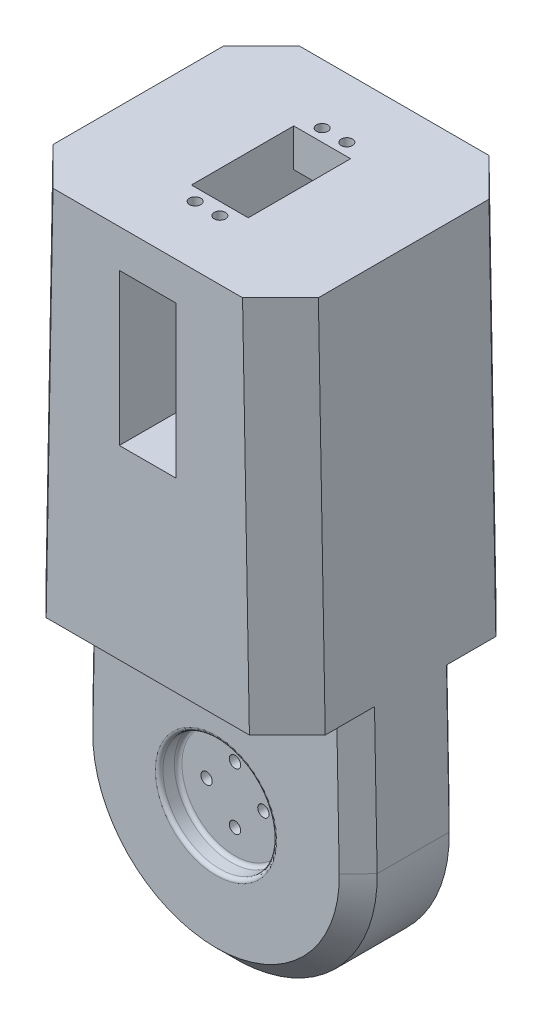
from build123d import *

# Parameters (mm, degrees)
BOSS_EXTRUDE1_DEPTH = 65
SKETCH2_W           = 18
SKETCH2_H           = 76
CUT_EXTRUDE1_DEPTH  = 48.5
CHAMFER1_SIZE       = 10
CHAMFER2_SIZE       = 5
SKETCH3_R           = 15
CUT_EXTRUDE2_DEPTH  = 5
SKETCH5_R           = 1.5
CUT_EXTRUDE3_DEPTH  = 3.75
FILLET1_R           = 1
SKETCH6_W           = 15
SKETCH6_H           = 40
CUT_EXTRUDE4_DEPTH  = 157.644501978
SKETCH7_R           = 1.5
SKETCH7_W           = 15
SKETCH7_H           = 27
CUT_EXTRUDE5_DEPTH  = 10


with BuildPart() as part:
    # Sketch1 → Boss-Extrude1 (new body)
    with BuildSketch(Plane.XY):
        with BuildLine():
            Line((-35, 137.5), (35, 137.5))
            Line((35, 137.5), (37.49377228, 0.68340342))
            ThreePointArc((37.49377228, 0.68340342), (0, -37.5), (-37.49377228, 0.68340342))
            Line((-37.49377228, 0.68340342), (-35, 137.5))
        make_face()
    extrude(amount=BOSS_EXTRUDE1_DEPTH)

    # Sketch2 → Cut-Extrude1 (cut, symmetric)
    with BuildSketch(Plane(origin=(0, 0, 0), x_dir=(0, 0, -1), z_dir=(1, 0, 0))):
        with Locations((-56, 0.5)):
            Rectangle(SKETCH2_W, SKETCH2_H)
        with Locations((-9, 0.5)):
            Rectangle(SKETCH2_W, SKETCH2_H)
    extrude(amount=CUT_EXTRUDE1_DEPTH, both=True, mode=Mode.SUBTRACT)

    # Chamfer1
    chamfer1_edges = [part.edges().sort_by_distance(p)[0] for p in [
        (-35.902242352, 88, 65),
        (35.902242352, 88, 0),
        (35.902242352, 88, 65),
        (-35.902242352, 88, 0),
    ]]
    chamfer(chamfer1_edges, length=CHAMFER1_SIZE)

    # Chamfer2
    chamfer2_edges = [part.edges().sort_by_distance(p)[0] for p in [
        (0, -37.5, 18),
        (0, -37.5, 47),
        (37.149128492, 19.59170171, 47),
        (-37.149128492, 19.59170171, 47),
        (37.149128492, 19.59170171, 18),
        (-37.149128492, 19.59170171, 18),
    ]]
    chamfer(chamfer2_edges, length=CHAMFER2_SIZE)

    # Sketch3 → Cut-Extrude2 (cut, symmetric)
    with BuildSketch(Plane.XY.offset(47)):
        Circle(SKETCH3_R)
    extrude(amount=CUT_EXTRUDE2_DEPTH, both=True, mode=Mode.SUBTRACT)

    # Sketch5 → Cut-Extrude3 (cut, symmetric)
    with BuildSketch(Plane.XY.offset(42)):
        with Locations((0, 7.5)):
            Circle(SKETCH5_R)
        with Locations((7.5, 0)):
            Circle(SKETCH5_R)
        with Locations((0, -7.5)):
            Circle(SKETCH5_R)
        with Locations((-7.5, 0)):
            Circle(SKETCH5_R)
    extrude(amount=CUT_EXTRUDE3_DEPTH, both=True, mode=Mode.SUBTRACT)

    # Fillet1
    fillet1_edges = [part.edges().sort_by_distance(p)[0] for p in [
        (-15, 0, 47),
        (-15, 0, 42),
    ]]
    fillet(fillet1_edges, radius=FILLET1_R)

    # Sketch6 → Cut-Extrude4 (cut, through all)
    with BuildSketch(Plane.XY.offset(65)):
        with Locations((0, 107.5)):
            Rectangle(SKETCH6_W, SKETCH6_H)
    extrude(amount=-CUT_EXTRUDE4_DEPTH, mode=Mode.SUBTRACT)

    # Sketch7 → Cut-Extrude5 (cut)
    with BuildSketch(Plane(origin=(0, 137.5, 0), x_dir=(1, 0, 0), z_dir=(0, 1, 0))):
        with Locations(Location((-3.25, -15.75, 0), (0, 0, 270))):
            Circle(SKETCH7_R)
        with Locations(Location((3.25, -15.75, 0), (0, 0, 270))):
            Circle(SKETCH7_R)
        with Locations(Location((3.25, -49.25, 0), (0, 0, 270))):
            Circle(SKETCH7_R)
        with Locations(Location((-3.25, -49.25, 0), (0, 0, 270))):
            Circle(SKETCH7_R)
        with Locations((0, -32.5)):
            Rectangle(SKETCH7_W, SKETCH7_H)
    extrude(amount=-CUT_EXTRUDE5_DEPTH, mode=Mode.SUBTRACT)


solid = part.part
